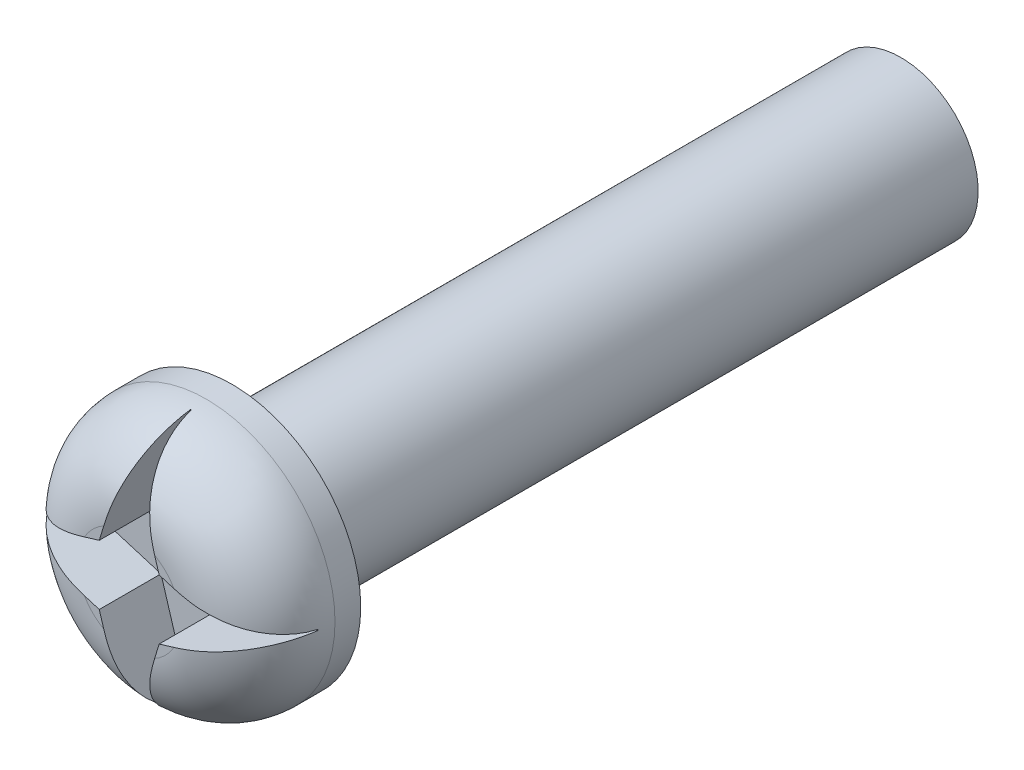
from build123d import *

# Parameters (mm, degrees)
SKETCH1_R           = 1.5
BOSS_EXTRUDE1_DEPTH = 13
SKETCH2_R           = 2.5
BOSS_EXTRUDE2_DEPTH = 2
FILLET1_R           = 1.5
CUT_EXTRUDE1_DEPTH  = 1.2


with BuildPart() as part:
    # Sketch1 → Boss-Extrude1 (new body)
    with BuildSketch(Plane.XY):
        with Locations(Location((0, 0, 0), (0, 0, 180))):
            Circle(SKETCH1_R)
    extrude(amount=BOSS_EXTRUDE1_DEPTH)

    # Sketch2 → Boss-Extrude2 (add)
    with BuildSketch(Plane.XY.offset(13)):
        Circle(SKETCH2_R)
    extrude(amount=BOSS_EXTRUDE2_DEPTH)

    # Fillet1
    fillet1_edges = [part.edges().sort_by_distance(p)[0] for p in [
        (-2.5, 0, 15),
    ]]
    fillet(fillet1_edges, radius=FILLET1_R)

    # Sketch3 → Cut-Extrude1 (cut)
    with BuildSketch(Plane.XY.offset(15)):
        Polygon((2.5, 0), (0.58177786, 0.58177786), (0, 2.5), (-0.58177786, 0.58177786), (-2.5, 0), (-0.58177786, -0.58177786), (0, -2.5), (0.58177786, -0.58177786), align=None)
    extrude(amount=-CUT_EXTRUDE1_DEPTH, mode=Mode.SUBTRACT)


solid = part.part
